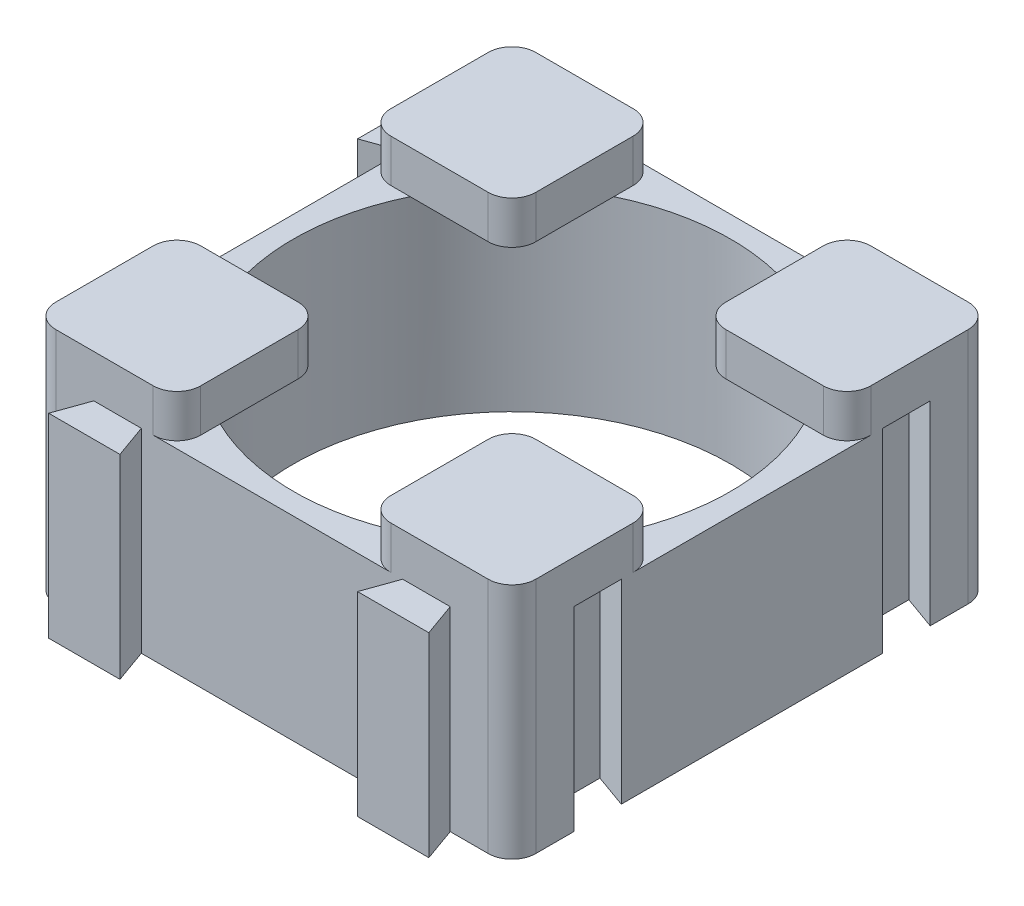
from build123d import *

# Parameters (mm, degrees)
SKETCH1_R           = 9.2
BOSS_EXTRUDE1_DEPTH = 8.2
BOSS_EXTRUDE2_DEPTH = 1.8


with BuildPart() as part:
    # Sketch1 → Boss-Extrude1 (new body)
    with BuildSketch(Plane(origin=(0, 0, 0), x_dir=(1, 0, 0), z_dir=(0, 1, 0))):
        with BuildLine():
            Line((-9.1, 10.1), (-7.5, 10.1))
            Line((-7.5, 10.1), (-8, 8.7))
            Line((-8, 8.7), (-5, 8.7))
            Line((-5, 8.7), (-5.5, 10.1))
            Line((-5.5, 10.1), (5.5, 10.1))
            Line((5.5, 10.1), (5, 8.7))
            Line((5, 8.7), (8, 8.7))
            Line((8, 8.7), (7.5, 10.1))
            Line((7.5, 10.1), (9.1, 10.1))
            ThreePointArc((9.1, 10.1), (9.807106781, 9.807106781), (10.1, 9.1))
            Line((10.1, 9.1), (10.1, 7.5))
            Line((10.1, 7.5), (8.7, 8))
            Line((8.7, 8), (8.7, 5))
            Line((8.7, 5), (10.1, 5.5))
            Line((10.1, 5.5), (10.1, -5.5))
            Line((10.1, -5.5), (8.7, -5))
            Line((8.7, -5), (8.7, -8))
            Line((8.7, -8), (10.1, -7.5))
            Line((10.1, -7.5), (10.1, -9.1))
            ThreePointArc((10.1, -9.1), (9.807106781, -9.807106781), (9.1, -10.1))
            Line((9.1, -10.1), (7.5, -10.1))
            Line((7.5, -10.1), (8, -11.5))
            Line((8, -11.5), (5, -11.5))
            Line((5, -11.5), (5.5, -10.1))
            Line((5.5, -10.1), (-5.5, -10.1))
            Line((-5.5, -10.1), (-5, -11.5))
            Line((-5, -11.5), (-8, -11.5))
            Line((-8, -11.5), (-7.5, -10.1))
            Line((-7.5, -10.1), (-9.1, -10.1))
            ThreePointArc((-9.1, -10.1), (-9.807106781, -9.807106781), (-10.1, -9.1))
            Line((-10.1, -9.1), (-10.1, -7.5))
            Line((-10.1, -7.5), (-11.5, -8))
            Line((-11.5, -8), (-11.5, -5))
            Line((-11.5, -5), (-10.1, -5.5))
            Line((-10.1, -5.5), (-10.1, 5.5))
            Line((-10.1, 5.5), (-11.5, 5))
            Line((-11.5, 5), (-11.5, 8))
            Line((-11.5, 8), (-10.1, 7.5))
            Line((-10.1, 7.5), (-10.1, 9.1))
            ThreePointArc((-10.1, 9.1), (-9.807106781, 9.807106781), (-9.1, 10.1))
        make_face()
        with Locations(Location((0, 0, 0), (0, 0, 270))):
            Circle(SKETCH1_R, mode=Mode.SUBTRACT)
    extrude(amount=BOSS_EXTRUDE1_DEPTH)

    # Sketch2 → Boss-Extrude2 (add)
    with BuildSketch(Plane(origin=(0, 8.2, 0), x_dir=(1, 0, 0), z_dir=(0, 1, 0))):
        with BuildLine():
            Line((-9.1, 4), (-5, 4))
            ThreePointArc((-5, 4), (-4.292893219, 4.292893219), (-4, 5))
            Line((-4, 5), (-4, 9.1))
            ThreePointArc((-4, 9.1), (-4.292893219, 9.807106781), (-5, 10.1))
            Line((-5, 10.1), (-9.1, 10.1))
            ThreePointArc((-9.1, 10.1), (-9.807106781, 9.807106781), (-10.1, 9.1))
            Line((-10.1, 9.1), (-10.1, 5))
            ThreePointArc((-10.1, 5), (-9.807106781, 4.292893219), (-9.1, 4))
        make_face()
        with BuildLine():
            Line((10.1, 9.1), (10.1, 5))
            ThreePointArc((10.1, 5), (9.807106781, 4.292893219), (9.1, 4))
            Line((9.1, 4), (5, 4))
            ThreePointArc((5, 4), (4.292893219, 4.292893219), (4, 5))
            Line((4, 5), (4, 9.1))
            ThreePointArc((4, 9.1), (4.292893219, 9.807106781), (5, 10.1))
            Line((5, 10.1), (9.1, 10.1))
            ThreePointArc((9.1, 10.1), (9.807106781, 9.807106781), (10.1, 9.1))
        make_face()
        with BuildLine():
            Line((9.1, -4), (5, -4))
            ThreePointArc((5, -4), (4.292893219, -4.292893219), (4, -5))
            Line((4, -5), (4, -9.1))
            ThreePointArc((4, -9.1), (4.292893219, -9.807106781), (5, -10.1))
            Line((5, -10.1), (9.1, -10.1))
            ThreePointArc((9.1, -10.1), (9.807106781, -9.807106781), (10.1, -9.1))
            Line((10.1, -9.1), (10.1, -5))
            ThreePointArc((10.1, -5), (9.807106781, -4.292893219), (9.1, -4))
        make_face()
        with BuildLine():
            Line((-4, -5), (-4, -9.1))
            ThreePointArc((-4, -9.1), (-4.292893219, -9.807106781), (-5, -10.1))
            Line((-5, -10.1), (-9.1, -10.1))
            ThreePointArc((-9.1, -10.1), (-9.807106781, -9.807106781), (-10.1, -9.1))
            Line((-10.1, -9.1), (-10.1, -5))
            ThreePointArc((-10.1, -5), (-9.807106781, -4.292893219), (-9.1, -4))
            Line((-9.1, -4), (-5, -4))
            ThreePointArc((-5, -4), (-4.292893219, -4.292893219), (-4, -5))
        make_face()
    extrude(amount=BOSS_EXTRUDE2_DEPTH)


solid = part.part
